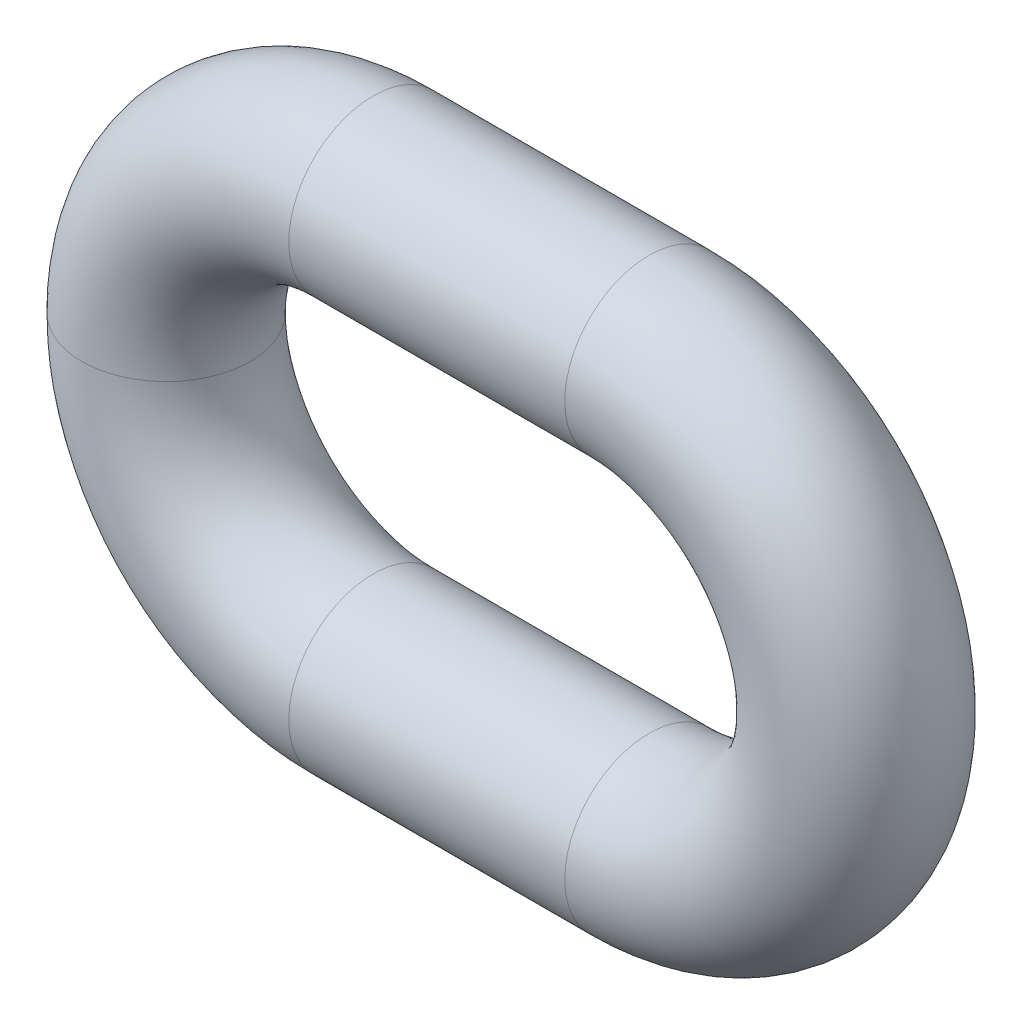
from build123d import *

# Parameters (mm, degrees)
SKETCH5_R = 2.794


with BuildPart() as part:
    # Sweep1: sweep along a path in Sketch1
    with BuildLine(Plane.XY) as sweep1_path:
        Line((4.064, 4.064), (13.208, 4.064))
        ThreePointArc((13.208, 4.064), (17.272, 0), (13.208, -4.064))
        Line((13.208, -4.064), (4.064, -4.064))
        ThreePointArc((4.064, -4.064), (0, 0), (4.064, 4.064))
    # Sketch5 → Sweep1 (sweep)
    with BuildSketch(Plane(origin=(0, 0, 0), x_dir=(1, 0, 0), z_dir=(0, 1, 0))):
        with Locations((-2.794, 0)):
            Circle(SKETCH5_R)
    sweep(path=sweep1_path.line)


solid = part.part
